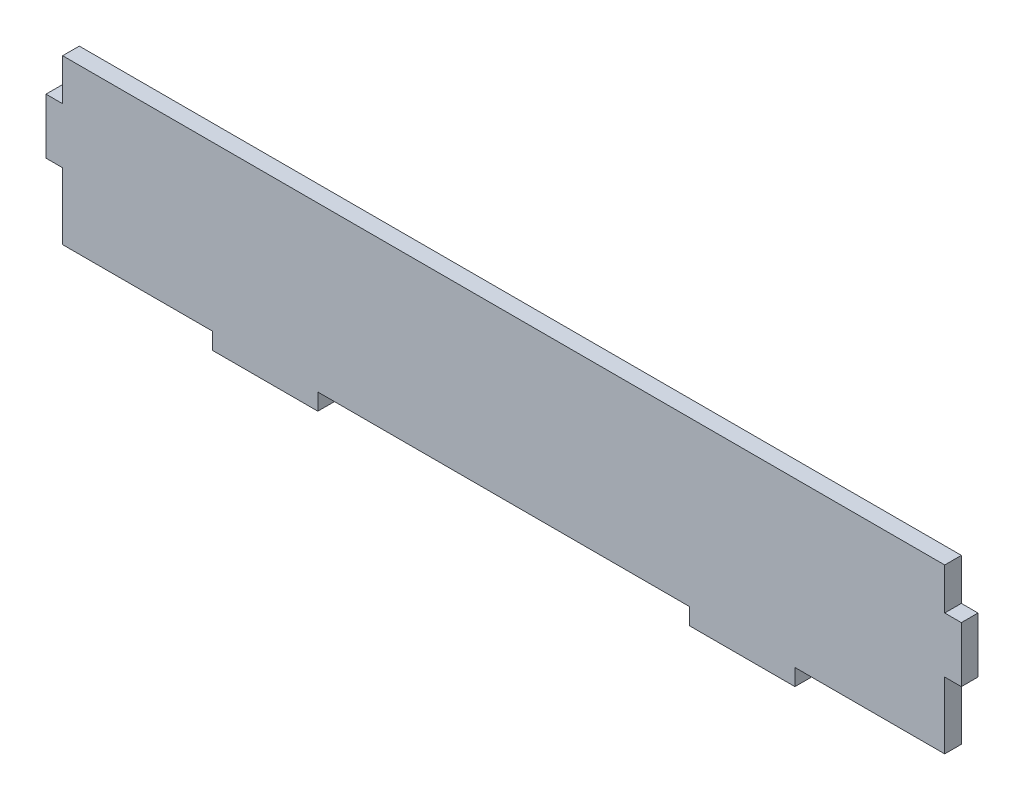
from build123d import *

# Parameters (mm, degrees)
ESQUISSE1_W             = 330
ESQUISSE1_H             = 65
BOSS_EXTRU_1_DEPTH      = 6
ESQUISSE2_W             = 134
ESQUISSE2_H             = 6
ESQUISSE2_W_2           = 6
ESQUISSE2_H_2           = 15
ENL_V_MAT_EXTRU_1_DEPTH = 6


with BuildPart() as part:
    # Esquisse1 → Boss.-Extru.1 (new body)
    with BuildSketch(Plane.XY):
        with Locations((-165, 32.5)):
            Rectangle(ESQUISSE1_W, ESQUISSE1_H)
    extrude(amount=BOSS_EXTRU_1_DEPTH)

    # Esquisse2 → Enlèv. mat.-Extru.1 (cut)
    with BuildSketch(Plane.XY.offset(6)):
        Polygon((-330, 0), (-270, 0), (-270, 6), (-324, 6), (-324, 30), (-330, 30), align=None)
        Polygon((0, 0), (-60, 0), (-60, 6), (-6, 6), (-6, 30), (0, 30), align=None)
        with Locations((-165, 3)):
            Rectangle(ESQUISSE2_W, ESQUISSE2_H)
        with Locations((-327, 57.5)):
            Rectangle(ESQUISSE2_W_2, ESQUISSE2_H_2)
        with Locations((-3, 57.5)):
            Rectangle(ESQUISSE2_W_2, ESQUISSE2_H_2)
    extrude(amount=-ENL_V_MAT_EXTRU_1_DEPTH, mode=Mode.SUBTRACT)


solid = part.part
